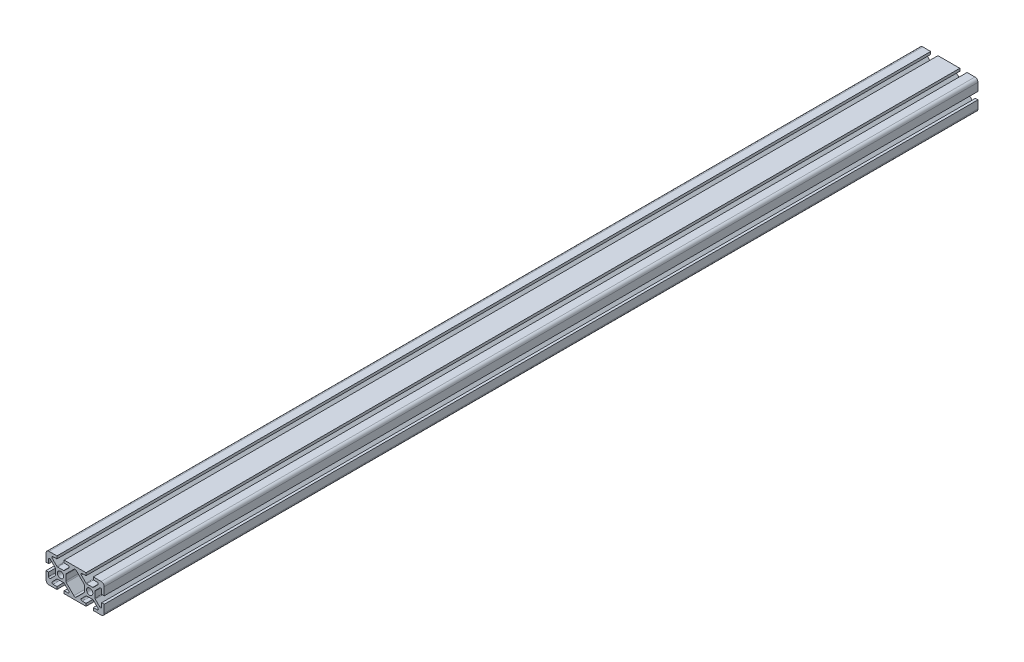
from build123d import *

# Parameters (mm, degrees)
BOSS_EXTRUDE1_DEPTH = 300
BOSS_EXTRUDE2_DEPTH = 300
FILLET1_R           = 0.75
FILLET2_R           = 1.25


with BuildPart() as part:
    # Sketch3 → Boss-Extrude1 (new, symmetric)
    with BuildSketch(Plane.XY):
        with BuildLine():
            Line((12.5, -10), (17.9, -10))
            ThreePointArc((17.9, -10), (19.38492424, -9.38492424), (20, -7.9))
            Line((20, -7.9), (20, -2.5))
            Line((20, -2.5), (18.213351365, -2.5))
            Line((18.213351365, -2.5), (18.213351365, -6.95))
            Line((18.213351365, -6.95), (13.6, -2.336648635))
            Line((13.6, -2.336648635), (13.6, 0))
            Line((13.6, 0), (12.15, 0))
            ThreePointArc((12.15, 0), (11.52027958, -1.52027958), (10, -2.15))
            Line((10, -2.15), (10, -3.6))
            Line((10, -3.6), (12.336648635, -3.6))
            Line((12.336648635, -3.6), (16.95, -8.213351365))
            Line((16.95, -8.213351365), (12.5, -8.213351365))
            Line((12.5, -8.213351365), (12.5, -10))
        make_face()
    extrude(amount=BOSS_EXTRUDE1_DEPTH, both=True)

    # Sketch4 → Boss-Extrude2 (add, symmetric)
    with BuildSketch(Plane.XY):
        with BuildLine():
            Line((10, -3.6), (7.663351365, -3.6))
            Line((7.663351365, -3.6), (3.05, -8.213351365))
            Line((3.05, -8.213351365), (7.5, -8.213351365))
            Line((7.5, -8.213351365), (7.5, -10))
            Line((7.5, -10), (0, -10))
            Line((0, -10), (0, -8.736648635))
            Line((0, -8.736648635), (6.4, -2.336648635))
            Line((6.4, -2.336648635), (6.4, 0))
            Line((6.4, 0), (7.85, 0))
            ThreePointArc((7.85, 0), (8.47972042, -1.52027958), (10, -2.15))
            Line((10, -2.15), (10, -3.6))
        make_face()
    extrude(amount=BOSS_EXTRUDE2_DEPTH, both=True)

    # Mirror1: part across plane


with BuildPart() as part_1:
    add(part.part)
    add(part.part.mirror(Plane(origin=(0, 0, 0), x_dir=(0, 0, 1), z_dir=(1, 0, 0))))

    # Mirror2: part across plane


with BuildPart() as part_2:
    add(part_1.part)
    add(part_1.part.mirror(Plane.ZX))

    # Fillet1
    fillet1_edges = [part_2.edges().sort_by_distance(p)[0] for p in [
        (18.213351365, 6.95, 0),
        (13.6, 2.336648635, 0),
        (12.336648635, 3.6, 0),
        (16.95, 8.213351365, 0),
        (3.05, 8.213351365, 0),
        (7.663351365, 3.6, 0),
        (-18.213351365, 6.95, 0),
        (-13.6, 2.336648635, 0),
        (-7.663351365, 3.6, 0),
        (-12.336648635, 3.6, 0),
        (-16.95, 8.213351365, 0),
        (-3.05, 8.213351365, 0),
        (16.95, -8.213351365, 0),
        (12.336648635, -3.6, 0),
        (13.6, -2.336648635, 0),
        (18.213351365, -6.95, 0),
        (3.05, -8.213351365, 0),
        (7.663351365, -3.6, 0),
        (-18.213351365, -6.95, 0),
        (-13.6, -2.336648635, 0),
        (-12.336648635, -3.6, 0),
        (-16.95, -8.213351365, 0),
        (-3.05, -8.213351365, 0),
        (-7.663351365, -3.6, 0),
    ]]
    fillet(fillet1_edges, radius=FILLET1_R)

    # Fillet2
    fillet2_edges = [part_2.edges().sort_by_distance(p)[0] for p in [
        (6.4, 2.336648635, 0),
        (0, 8.736648635, 0),
        (-6.4, 2.336648635, 0),
        (6.4, -2.336648635, 0),
        (-6.4, -2.336648635, 0),
        (0, -8.736648635, 0),
    ]]
    fillet(fillet2_edges, radius=FILLET2_R)


solid = part_2.part
